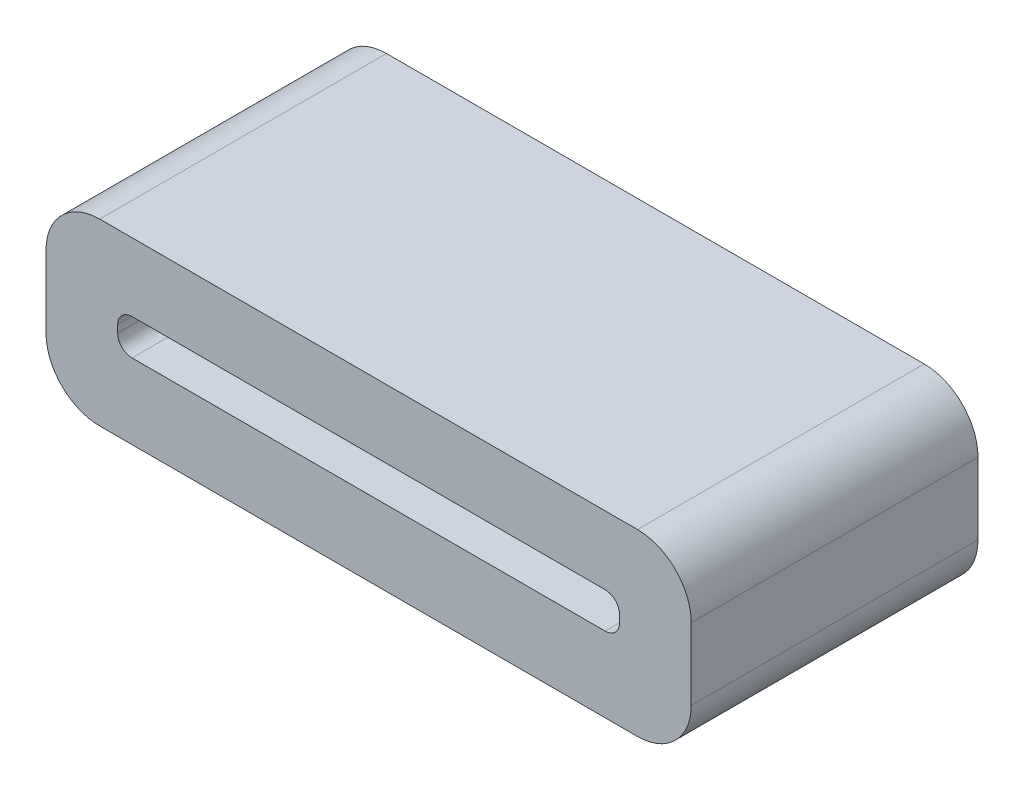
from build123d import *

# Parameters (mm, degrees)
EXTRUSION1_DEPTH        = 8
ENL_V_MAT_EXTRU_1_DEPTH = 8


with BuildPart() as part:
    # Esquisse1 → Extrusion1 (new body)
    with BuildSketch(Plane.XY):
        with BuildLine():
            Line((1.5, 0), (16.5, 0))
            ThreePointArc((16.5, 0), (17.560660172, 0.439339828), (18, 1.5))
            Line((18, 1.5), (18, 3.5))
            ThreePointArc((18, 3.5), (17.560660172, 4.560660172), (16.5, 5))
            Line((16.5, 5), (1.5, 5))
            ThreePointArc((1.5, 5), (0.439339828, 4.560660172), (0, 3.5))
            Line((0, 3.5), (0, 1.5))
            ThreePointArc((0, 1.5), (0.439339828, 0.439339828), (1.5, 0))
        make_face()
    extrude(amount=EXTRUSION1_DEPTH)

    # Esquisse2 → Enlèv. mat.-Extru.1 (cut)
    with BuildSketch(Plane.XY.offset(8)):
        with BuildLine():
            Line((2.4, 3.095375723), (15.6, 3.095375723))
            ThreePointArc((15.6, 3.095375723), (15.882842712, 2.978218435), (16, 2.695375723))
            Line((16, 2.695375723), (16, 2.495375723))
            ThreePointArc((16, 2.495375723), (15.882842712, 2.21253301), (15.6, 2.095375723))
            Line((15.6, 2.095375723), (2.4, 2.095375723))
            ThreePointArc((2.4, 2.095375723), (2.117157288, 2.21253301), (2, 2.495375723))
            Line((2, 2.495375723), (2, 2.695375723))
            ThreePointArc((2, 2.695375723), (2.117157288, 2.978218435), (2.4, 3.095375723))
        make_face()
    extrude(amount=-ENL_V_MAT_EXTRU_1_DEPTH, mode=Mode.SUBTRACT)


solid = part.part
